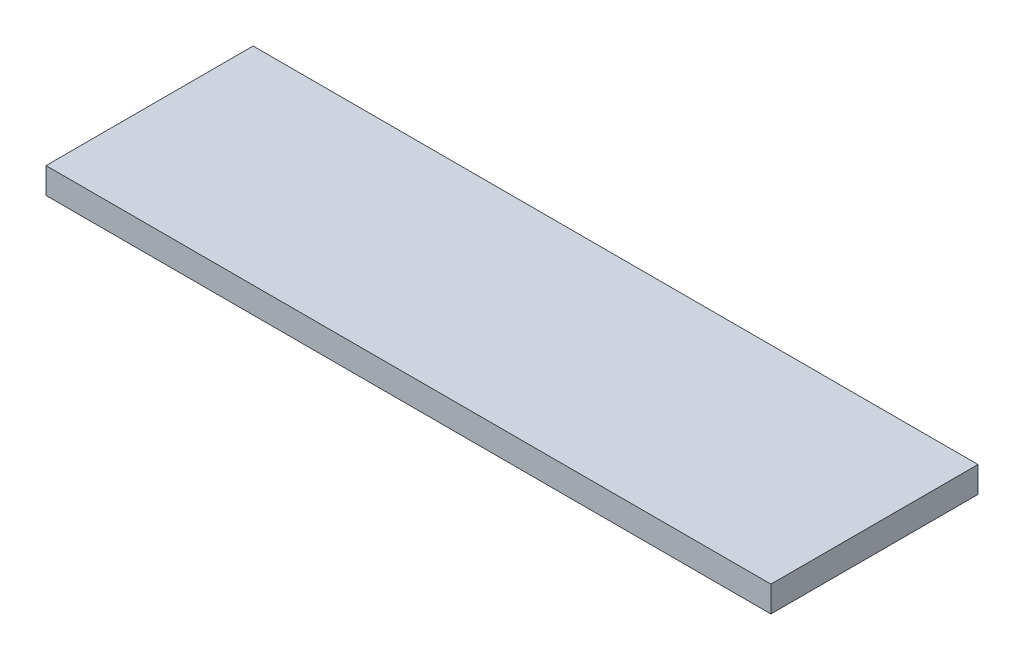
from build123d import *

# Parameters (mm, degrees)
SKETCH1_W           = 88.9
SKETCH1_H           = 25.4
BOSS_EXTRUDE1_DEPTH = 3.175


with BuildPart() as part:
    # Sketch1 → Boss-Extrude1 (new body)
    with BuildSketch(Plane(origin=(0, 0, 0), x_dir=(1, 0, 0), z_dir=(0, 1, 0))):
        with Locations((44.45, 12.7)):
            Rectangle(SKETCH1_W, SKETCH1_H)
    extrude(amount=BOSS_EXTRUDE1_DEPTH)


solid = part.part
